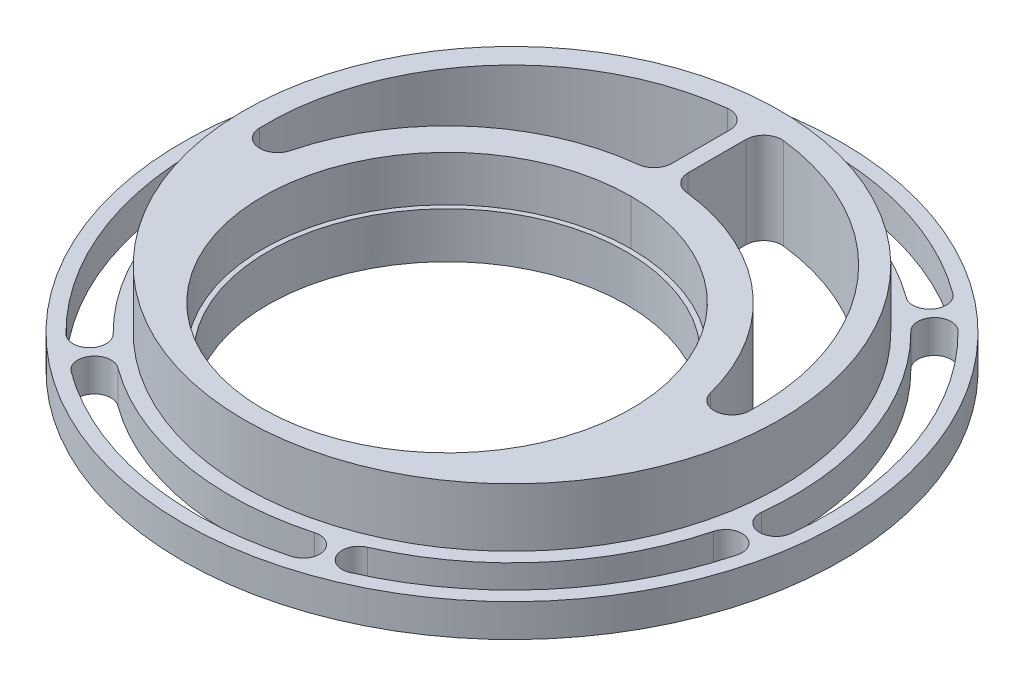
from build123d import *

# Parameters (mm, degrees)
SKETCH1_R               = 61.912499999999994
SKETCH1_R_2             = 35.05199999999999
BOSS_EXTRUDE1_DEPTH     = 4.521199999999999
SKETCH3_R               = 52.38750000000001
BOSS_EXTRUDE2_DEPTH     = 11.43
SKETCH4_R               = 35.05199999999999
CUT_EXTRUDE1_DEPTH      = 89.99862973068743
SKETCH9_R               = 36.000000009
CUT_EXTRUDE3_DEPTH      = 8.889999999999999
CUT_EXTRUDE6_DEPTH      = 4.5212
CIRPATTERN2_COUNT       = 6
CUT_EXTRUDE7_DEPTH      = 89.99862973068743
CUT_EXTRUDE7_DEPTH_BACK = 89.99862973068743
SKETCH28_R              = 61.912499999999994
BOSS_EXTRUDE6_DEPTH     = 1.9049999999999998
SKETCH29_R              = 64.4525
SKETCH29_R_2            = 61.912499999999994
BOSS_EXTRUDE7_DEPTH     = 6.4262


with BuildPart() as part:
    # Sketch1 → Boss-Extrude1 (new body)
    with BuildSketch(Plane(origin=(0, 0, 0), x_dir=(1, 0, 0), z_dir=(0, 1, 0))):
        with Locations(Location((0, 0, 0), (0, 0, 270))):
            Circle(SKETCH1_R)
        with Locations(Location((0, -12.7, 0), (0, 0, 270))):
            Circle(SKETCH1_R_2, mode=Mode.SUBTRACT)
    extrude(amount=BOSS_EXTRUDE1_DEPTH)

    # Sketch3 → Boss-Extrude2 (add)
    with BuildSketch(Plane(origin=(0, 4.521199999999999, 0), x_dir=(1, 0, 0), z_dir=(0, 1, 0))):
        with Locations(Location((0, 0, 0), (0, 0, 270))):
            Circle(SKETCH3_R)
    extrude(amount=BOSS_EXTRUDE2_DEPTH)

    # Sketch4 → Cut-Extrude1 (cut, through all)
    with BuildSketch(Plane.XZ):
        with Locations(Location((0, 12.7, 0), (0, 0, 270))):
            Circle(SKETCH4_R)
    extrude(amount=-CUT_EXTRUDE1_DEPTH, mode=Mode.SUBTRACT)

    # Sketch9 → Cut-Extrude3 (cut)
    with BuildSketch(Plane(origin=(0, 15.951199999999998, 0), x_dir=(1, 0, 0), z_dir=(0, 1, 0))):
        with Locations(Location((0, -12.7, 0), (0, 0, 270))):
            Circle(SKETCH9_R)
    extrude(amount=-CUT_EXTRUDE3_DEPTH, mode=Mode.SUBTRACT)

    # Sketch26 → Cut-Extrude6 (cut)
    with BuildSketch(Plane(origin=(0, 4.521199999999999, 0), x_dir=(1, 0, 0), z_dir=(0, 1, 0))):
        with BuildLine():
            ThreePointArc((-61.31569012651589, 6.729759543927394), (-58.13186307655321, -20.629833117571987), (-43.356751785354874, -43.87591131626929))
            ThreePointArc((-43.356751785354874, -43.87591131626929), (-38.740981882715914, -43.84844086137017), (-38.76845233761503, -39.23267095873121))
            ThreePointArc((-38.76845233761503, -39.23267095873121), (-51.979963216279714, -18.446647154542955), (-54.82685654096325, 6.017571690194909))
            ThreePointArc((-54.82685654096325, 6.017571690194909), (-57.71517940687332, 9.618082409837466), (-61.31569012651589, 6.729759543927394))
        make_face()
    cut_extrude6 = extrude(amount=-CUT_EXTRUDE6_DEPTH, mode=Mode.SUBTRACT)

    # CirPattern2: Cut-Extrude6 ×6 about axis
    cirpattern2_axis = Axis((1.126e-14, 0, 2.9e-14), (0, 1, 0))
    for i in range(1, CIRPATTERN2_COUNT):
        add(cut_extrude6.rotate(cirpattern2_axis, i * 360 / CIRPATTERN2_COUNT), mode=Mode.SUBTRACT)

    # Sketch27 → Cut-Extrude7 (cut, two sides: drawn at the far end of the back side and taken through both)
    with BuildSketch(Plane(origin=(0, 15.951199999999998, 0), x_dir=(1, 0, 0), z_dir=(0, 1, 0)).offset(-CUT_EXTRUDE7_DEPTH_BACK)):
        with BuildLine():
            Line((-1.5874999999999995, 44.15876017281289), (-1.5874999999999981, 32.860162500535104))
            ThreePointArc((-1.5874999999999981, 32.860162500535104), (-2.4771920261720077, 30.53144033991194), (-4.692981403795235, 29.38917231671267))
            ThreePointArc((-4.692981403795235, 29.38917231671267), (-27.80971442943092, 19.239666311904415), (-41.043217293560936, -2.2608039123771086))
            ThreePointArc((-41.043217293560936, -2.2608039123771086), (-44.807125891813406, -4.871764870752282), (-47.91871765916517, -1.509902033647368))
            ThreePointArc((-47.91871765916517, -1.509902033647368), (-36.283267418970276, 31.337003871676934), (-5.479142857142855, 47.62837704353388))
            ThreePointArc((-5.479142857142855, 47.62837704353388), (-2.7558281236719524, 46.76563211813081), (-1.5874999999999995, 44.15876017281289))
        make_face()
        with BuildLine():
            Line((1.5874999999999995, 44.15876017281289), (1.5874999999999981, 32.860162500535104))
            ThreePointArc((1.5874999999999981, 32.860162500535104), (2.4771920261720073, 30.53144033991194), (4.692981403795235, 29.38917231671267))
            ThreePointArc((4.692981403795235, 29.38917231671267), (27.809714429430915, 19.23966631190442), (41.043217293560936, -2.2608039123771086))
            ThreePointArc((41.043217293560936, -2.2608039123771086), (44.807125891813406, -4.871764870752282), (47.91871765916517, -1.509902033647368))
            ThreePointArc((47.91871765916517, -1.509902033647368), (36.28326741897028, 31.337003871676927), (5.479142857142855, 47.62837704353388))
            ThreePointArc((5.479142857142855, 47.62837704353388), (2.755828123671953, 46.76563211813081), (1.5874999999999995, 44.15876017281289))
        make_face()
    extrude(amount=CUT_EXTRUDE7_DEPTH + CUT_EXTRUDE7_DEPTH_BACK, mode=Mode.SUBTRACT)

    # Sketch28 → Boss-Extrude6 (add)
    with BuildSketch(Plane.XZ):
        with Locations(Location((0, 0, 0), (0, 0, 270))):
            Circle(SKETCH28_R)
        with BuildLine():
            ThreePointArc((-59.67602970675995, -15.610092813558284), (-57.34435464364428, -11.626454047298918), (-53.3607158773849, -13.958129110414555))
            ThreePointArc((-53.3607158773849, -13.958129110414557), (-41.96524665862243, -35.792645055806894), (-22.202058317679402, -50.490236419216366))
            ThreePointArc((-22.202058317679395, -50.490236419216366), (-20.528086000825798, -54.79185275524728), (-24.829702336856723, -56.465825072100834))
            ThreePointArc((-24.82970233685672, -56.465825072100834), (-46.93189109392796, -40.02875363482713), (-59.67602970675995, -15.610092813558284))
        make_face(mode=Mode.SUBTRACT)
        with BuildLine():
            Line((-1.5874999999999986, -32.860162500535104), (-1.5874999999999995, -44.15876017281289))
            ThreePointArc((-1.5874999999999977, -44.15876017281289), (-2.755828123671947, -46.76563211813081), (-5.4791428571428495, -47.62837704353388))
            ThreePointArc((-5.479142857142854, -47.62837704353389), (-36.28326741897027, -31.337003871676924), (-47.918717659165196, 1.5099020336473608))
            ThreePointArc((-47.918717659165196, 1.5099020336473605), (-44.80712589181342, 4.871764870752293), (-41.04321729356092, 2.2608039123771135))
            ThreePointArc((-41.04321729356093, 2.2608039123771135), (-27.8097144294309, -19.239666311904422), (-4.692981403795217, -29.389172316712667))
            ThreePointArc((-4.692981403795219, -29.38917231671267), (-2.4771920261720033, -30.531440339911942), (-1.587499999999999, -32.860162500535104))
        make_face(mode=Mode.SUBTRACT)
        with BuildLine():
            ThreePointArc((-16.319277921405433, -59.48600412982813), (-18.603372760928732, -55.47489490866959), (-14.592263539770187, -53.1908000691463))
            ThreePointArc((-14.592263539770187, -53.19080006914629), (10.014716557657184, -54.239292210350484), (32.62479822328402, -44.47266472902207))
            ThreePointArc((32.62479822328402, -44.47266472902206), (37.18709340604772, -45.173770345410375), (36.48598778965936, -49.73606552817407))
            ThreePointArc((36.48598778965937, -49.73606552817408), (11.199971982625161, -60.6585867523998), (-16.319277921405433, -59.48600412982813))
        make_face(mode=Mode.SUBTRACT)
        with BuildLine():
            Line((1.5874999999999995, -44.15876017281289), (1.5874999999999981, -32.860162500535104))
            ThreePointArc((1.5874999999999986, -32.860162500535104), (2.4771920261720077, -30.53144033991194), (4.692981403795235, -29.38917231671267))
            ThreePointArc((4.692981403795236, -29.389172316712674), (27.80971442943091, -19.239666311904415), (41.043217293560936, 2.260803912377108))
            ThreePointArc((41.043217293560936, 2.2608039123771118), (44.80712589181342, 4.871764870752304), (47.91871765916518, 1.509902033647373))
            ThreePointArc((47.918717659165196, 1.5099020336473767), (36.28326741897028, -31.337003871676927), (5.479142857142865, -47.62837704353388))
            ThreePointArc((5.479142857142865, -47.628377043533874), (2.755828123671944, -46.765632118130824), (1.587499999999999, -44.15876017281289))
        make_face(mode=Mode.SUBTRACT)
        with BuildLine():
            ThreePointArc((43.35675178535485, -43.8759113162693), (38.740981882715914, -43.848440861370165), (38.76845233761502, -39.232670958731234))
            ThreePointArc((38.76845233761502, -39.232670958731234), (51.9799632162797, -18.44664715454299), (54.82685654096326, 6.017571690194891))
            ThreePointArc((54.826856540963256, 6.017571690194889), (57.715179406873325, 9.61808240983748), (61.31569012651589, 6.729759543927382))
            ThreePointArc((61.3156901265159, 6.729759543927382), (58.131863076553195, -20.62983311757202), (43.35675178535486, -43.87591131626931))
        make_face(mode=Mode.SUBTRACT)
        with BuildLine():
            ThreePointArc((-43.356751785354874, 43.87591131626928), (-38.740981882715914, 43.84844086137017), (-38.76845233761503, 39.23267095873121))
            ThreePointArc((-38.76845233761503, 39.23267095873122), (-51.9799632162797, 18.446647154542973), (-54.82685654096326, -6.017571690194876))
            ThreePointArc((-54.826856540963256, -6.01757169019488), (-57.71517940687332, -9.618082409837479), (-61.31569012651589, -6.729759543927381))
            ThreePointArc((-61.31569012651589, -6.729759543927381), (-58.1318630765532, 20.629833117572), (-43.356751785354874, 43.875911316269274))
        make_face(mode=Mode.SUBTRACT)
        with BuildLine():
            ThreePointArc((16.31927792140503, 59.486004129828245), (18.603372760928355, 55.47489490866972), (14.592263539769828, 53.1908000691464))
            ThreePointArc((14.592263539769828, 53.1908000691464), (-10.014716557657586, 54.23929221035041), (-32.624798223284365, 44.472664729021815))
            ThreePointArc((-32.62479822328437, 44.472664729021815), (-37.187093406048064, 45.17377034541014), (-36.48598778965972, 49.73606552817383))
            ThreePointArc((-36.48598778965972, 49.73606552817383), (-11.19997198262558, 60.65858675239972), (16.31927792140503, 59.48600412982824))
        make_face(mode=Mode.SUBTRACT)
        with BuildLine():
            ThreePointArc((-1.342e-14, 47.75199999999998), (24.785506894150842, 37.48550689415085), (35.05199999999998, 12.7))
            ThreePointArc((35.05199999999998, 12.69999999999999), (24.785506894150842, -12.085506894150853), (-6.44e-15, -22.35199999999998))
            ThreePointArc((-6.44e-15, -22.35199999999998), (-35.05199999999998, 12.700000000000003), (-1.342e-14, 47.75199999999998))
        make_face(mode=Mode.SUBTRACT)
        with BuildLine():
            ThreePointArc((59.676029706759834, 15.61009281355871), (57.344354643644195, 11.626454047299315), (53.3607158773848, 13.958129110414966))
            ThreePointArc((53.3607158773848, 13.958129110414966), (41.96524665862217, 35.79264505580721), (22.20205831767902, 50.49023641921653))
            ThreePointArc((22.20205831767902, 50.49023641921653), (20.528086000825407, 54.79185275524743), (24.829702336856318, 56.465825072101026))
            ThreePointArc((24.829702336856318, 56.46582507210103), (46.931891093927675, 40.02875363482747), (59.676029706759834, 15.610092813558712))
        make_face(mode=Mode.SUBTRACT)
    extrude(amount=BOSS_EXTRUDE6_DEPTH)

    # Sketch29 → Boss-Extrude7 (add, through all)
    with BuildSketch(Plane(origin=(0, 4.521199999999999, 0), x_dir=(1, 0, 0), z_dir=(0, 1, 0))):
        with Locations(Location((0, 0, 0), (0, 0, 270))):
            Circle(SKETCH29_R)
        Circle(SKETCH29_R_2, mode=Mode.SUBTRACT)
    extrude(amount=-BOSS_EXTRUDE7_DEPTH)


solid = part.part
